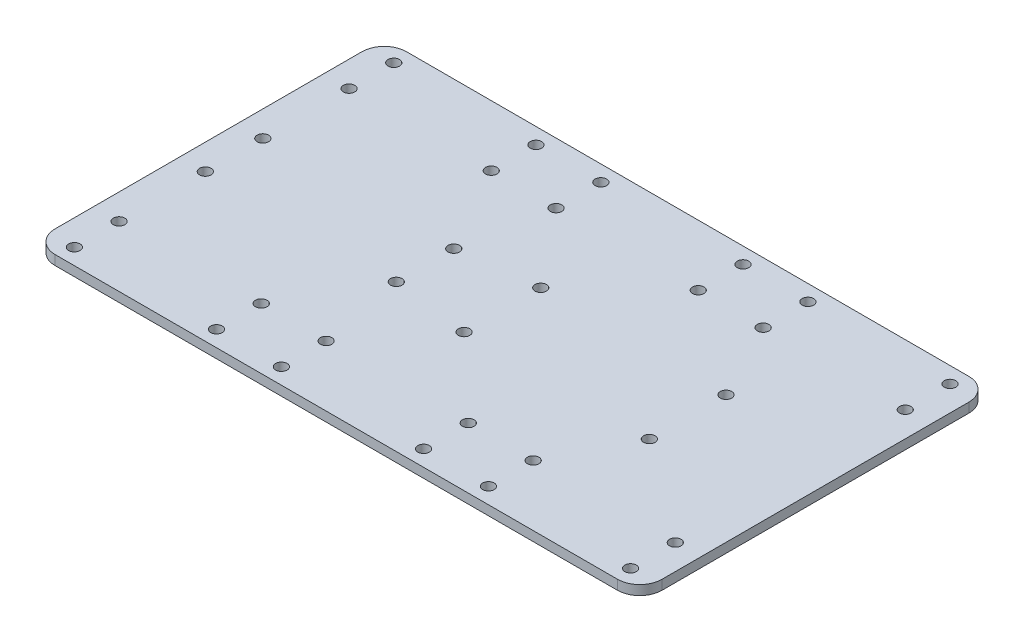
from build123d import *

# Parameters (mm, degrees)
SKETCH1_W            = 190
SKETCH1_H            = 110
BOSS_EXTRUDE1_DEPTH  = 3
M3_CLEARANCE_HOLE1_D = 3.6
FILLET1_R            = 7


with BuildPart() as part:
    # Sketch1 → Boss-Extrude1 (new body)
    with BuildSketch(Plane(origin=(0, 0, 0), x_dir=(1, 0, 0), z_dir=(0, 1, 0))):
        with Locations((95, 55)):
            Rectangle(SKETCH1_W, SKETCH1_H)
    extrude(amount=BOSS_EXTRUDE1_DEPTH)

    # M3 Clearance Hole1 (through all)
    with Locations(Plane(origin=(0, 3, 0), x_dir=(1, 0, 0), z_dir=(0, 1, 0))):
        with Locations((8, 105), (52.5, 105), (52.5, 91), (8, 91), (52.5, 19), (52.5, 5), (8, 19), (8, 5), (72.811, 105), (117.311, 105), (117.311, 91), (72.811, 91), (137.622, 105), (182.122, 105), (182.122, 91), (137.622, 91), (72.811, 19), (117.311, 19), (137.622, 19), (182.122, 19), (182.122, 5), (137.622, 5), (117.311, 5), (72.811, 5), (8, 64), (8, 46), (67.78, 64), (67.78, 46), (92, 67), (92, 43), (150, 43), (150, 67)):
            Hole(M3_CLEARANCE_HOLE1_D / 2)

    # Fillet1
    fillet1_edges = [part.edges().sort_by_distance(p)[0] for p in [
        (0, 1.5, -110),
        (190, 1.5, -110),
        (190, 1.5, 0),
        (0, 1.5, 0),
    ]]
    fillet(fillet1_edges, radius=FILLET1_R)


solid = part.part
